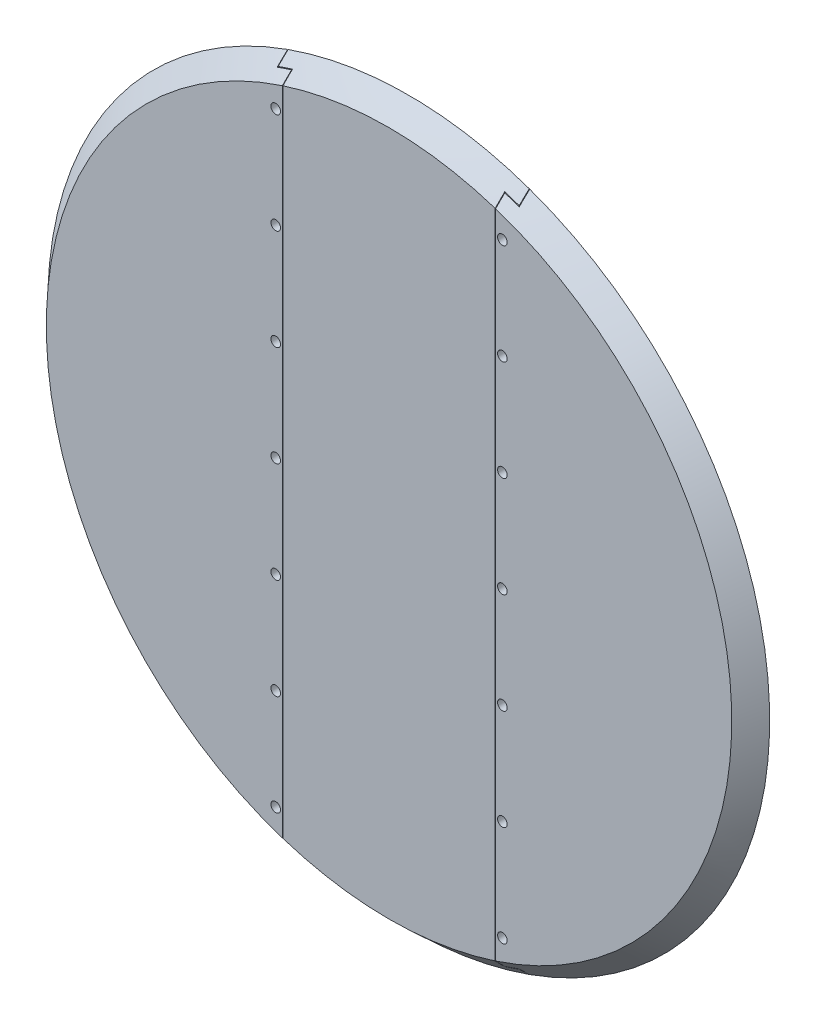
from build123d import *

# Parameters (mm, degrees)
SKETCH1_R               = 1000
BOSS_EXTRUDE2_DEPTH     = 1
DOME1_FACE_RADIUS       = 1000
DOME1_HEIGHT            = 1000
CUT_EXTRUDE1_START      = -300
SKETCH2_R               = 1000
CUT_EXTRUDE1_DEPTH      = 300
SKETCH4_R               = 1000
CUT_EXTRUDE2_DEPTH      = 660
CUT_EXTRUDE5_DEPTH      = 1274.906982476
CUT_EXTRUDE5_DEPTH_BACK = 1274.906982476
CUT_EXTRUDE6_DEPTH      = 1065.48062453
CUT_EXTRUDE6_DEPTH_BACK = 1065.48062453
SKETCH7_R               = 10


with BuildPart() as part:
    # Sketch1 → Boss-Extrude2 (new body)
    with BuildSketch(Plane.XY):
        Circle(SKETCH1_R)
    extrude(amount=BOSS_EXTRUDE2_DEPTH)

    # Dome1: a dome of height H over a round flat face of radius A is a cap of a sphere of radius (A * A + H * H) / (2 * H)
    dome1_r = (DOME1_FACE_RADIUS * DOME1_FACE_RADIUS + DOME1_HEIGHT * DOME1_HEIGHT) / (2 * DOME1_HEIGHT)
    dome1_base = Plane((0, 0, 1), z_dir=(0, 0, 1))
    with Locations(dome1_base.offset(DOME1_HEIGHT - dome1_r)):
        dome1_ball = Sphere(dome1_r, mode=Mode.PRIVATE)
    add(split(dome1_ball, bisect_by=dome1_base, keep=Keep.TOP, mode=Mode.PRIVATE))

    # Sketch2 → Cut-Extrude1 (cut)
    with BuildSketch(Plane.XY.offset(1001).offset(CUT_EXTRUDE1_START)):
        Circle(SKETCH2_R)
    extrude(amount=CUT_EXTRUDE1_DEPTH, mode=Mode.SUBTRACT)

    # Sketch4 → Cut-Extrude2 (cut)
    with BuildSketch(Plane(origin=(0, 0, 0), x_dir=(-1, 0, 0), z_dir=(0, 0, -1))):
        Circle(SKETCH4_R)
    extrude(amount=-CUT_EXTRUDE2_DEPTH, mode=Mode.SUBTRACT)

    # Sketch6 → Cut-Extrude5 (cut, two sides: drawn at the far end of the back side and taken through both)
    with BuildSketch(Plane(origin=(0, 0, 0), x_dir=(1, 0, 0), z_dir=(0, 1, 0)).offset(-CUT_EXTRUDE5_DEPTH_BACK)):
        Polygon((-251.142938543, -681), (-251.142938543, -660), (-252.142938543, -660), (-252.142938543, -682), (-222.142938543, -682), (-222.142938543, -701), (-221.142938543, -701), (-221.142938543, -681), align=None)
        Polygon((251.142938543, -660), (252.142938543, -660), (252.142938543, -682), (222.142938543, -682), (222.142938543, -701), (221.142938543, -701), (221.142938543, -681), (251.142938543, -681), align=None)
    extrude(amount=CUT_EXTRUDE5_DEPTH + CUT_EXTRUDE5_DEPTH_BACK, mode=Mode.SUBTRACT)


with BuildPart() as cut_extrude5_piece_1:
    # of the separate pieces the step leaves, piece 1, a body of its own (cut_extrude5_pieces)
    add(part.part.solids().sort_by_distance((251.142938543, 688.859364762, 681))[0])


with BuildPart() as cut_extrude5_piece_2:
    # of the separate pieces the step leaves, piece 2, a body of its own (cut_extrude5_pieces)
    add(part.part.solids().sort_by_distance((222.142938543, 678.713868177, 701))[0])


with BuildPart() as cut_extrude5_piece_3:
    # of the separate pieces the step leaves, piece 3, a body of its own (cut_extrude5_pieces)
    add(part.part.solids().sort_by_distance((-252.142938543, 708.620447449, 660))[0])


with BuildPart() as cut_extrude6_tool:
    # Sketch7 → Cut-Extrude6 (new, two sides: drawn at the far end of the back side and taken through both)
    with BuildSketch(Plane(origin=(0, 0, 660), x_dir=(-1, 0, 0), z_dir=(0, 0, -1)).offset(-CUT_EXTRUDE6_DEPTH_BACK)):
        with Locations((-236.142938543, 0)):
            Circle(SKETCH7_R)
        with Locations((-236.142938543, 210)):
            Circle(SKETCH7_R)
        with Locations((-236.142938543, 420)):
            Circle(SKETCH7_R)
        with Locations((-236.142938543, 630)):
            Circle(SKETCH7_R)
        with Locations((-236.142938543, -210)):
            Circle(SKETCH7_R)
        with Locations((-236.142938543, -420)):
            Circle(SKETCH7_R)
        with Locations((-236.142938543, -630)):
            Circle(SKETCH7_R)
        with Locations((236.142938543, 0)):
            Circle(SKETCH7_R)
        with Locations((236.142938543, 210)):
            Circle(SKETCH7_R)
        with Locations((236.142938543, 420)):
            Circle(SKETCH7_R)
        with Locations((236.142938543, 630)):
            Circle(SKETCH7_R)
        with Locations((236.142938543, -210)):
            Circle(SKETCH7_R)
        with Locations((236.142938543, -420)):
            Circle(SKETCH7_R)
        with Locations((236.142938543, -630)):
            Circle(SKETCH7_R)
    extrude(amount=CUT_EXTRUDE6_DEPTH + CUT_EXTRUDE6_DEPTH_BACK)


with BuildPart() as cut_extrude5_piece_1_1:
    add(cut_extrude5_piece_1.part)

    # Cut-Extrude6: cut by cut_extrude6_tool
    add(cut_extrude6_tool.part, mode=Mode.SUBTRACT)


with BuildPart() as cut_extrude5_piece_2_1:
    add(cut_extrude5_piece_2.part)

    # Cut-Extrude6: cut by cut_extrude6_tool
    add(cut_extrude6_tool.part, mode=Mode.SUBTRACT)


with BuildPart() as cut_extrude5_piece_3_1:
    add(cut_extrude5_piece_3.part)

    # Cut-Extrude6: cut by cut_extrude6_tool
    add(cut_extrude6_tool.part, mode=Mode.SUBTRACT)


solid = Compound([cut_extrude5_piece_1_1.part, cut_extrude5_piece_2_1.part, cut_extrude5_piece_3_1.part])
